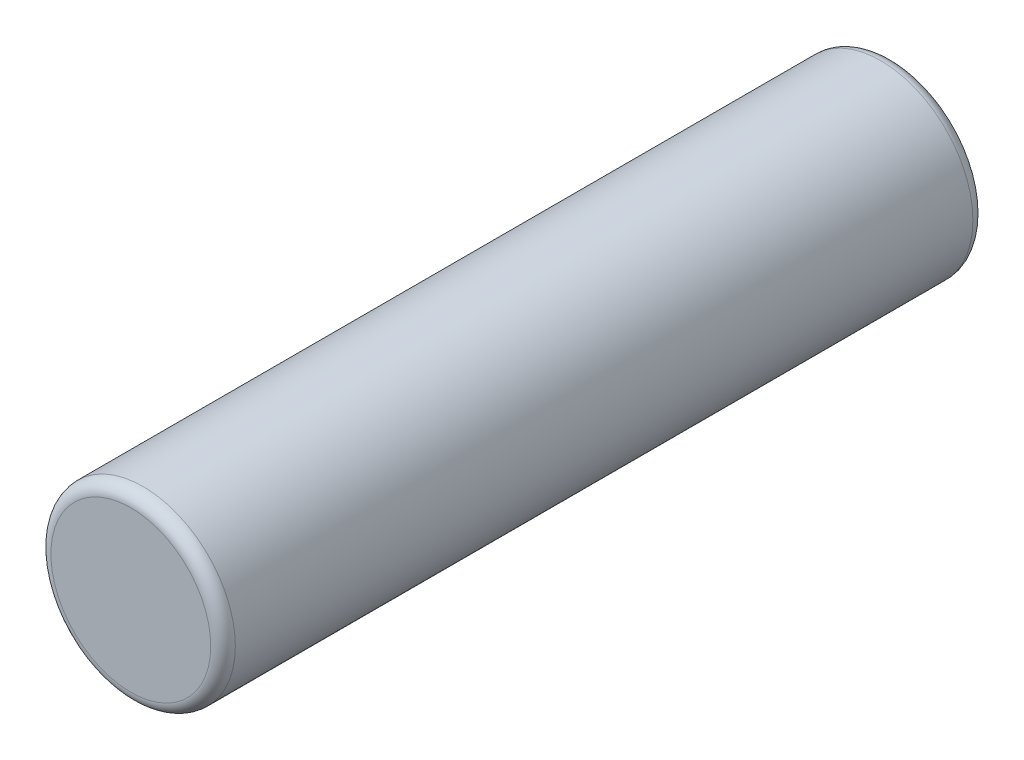
from build123d import *

# Parameters (mm, degrees)
SKETCH1_R           = 7.5
BOSS_EXTRUDE1_DEPTH = 62
FILLET1_R           = 1


with BuildPart() as part:
    # Sketch1 → Boss-Extrude1 (new body)
    with BuildSketch(Plane.XY):
        Circle(SKETCH1_R)
    extrude(amount=BOSS_EXTRUDE1_DEPTH)

    # Fillet1
    fillet1_edges = [part.edges().sort_by_distance(p)[0] for p in [
        (-7.5, 0, 0),
        (-7.5, 0, 62),
    ]]
    fillet(fillet1_edges, radius=FILLET1_R)


solid = part.part
